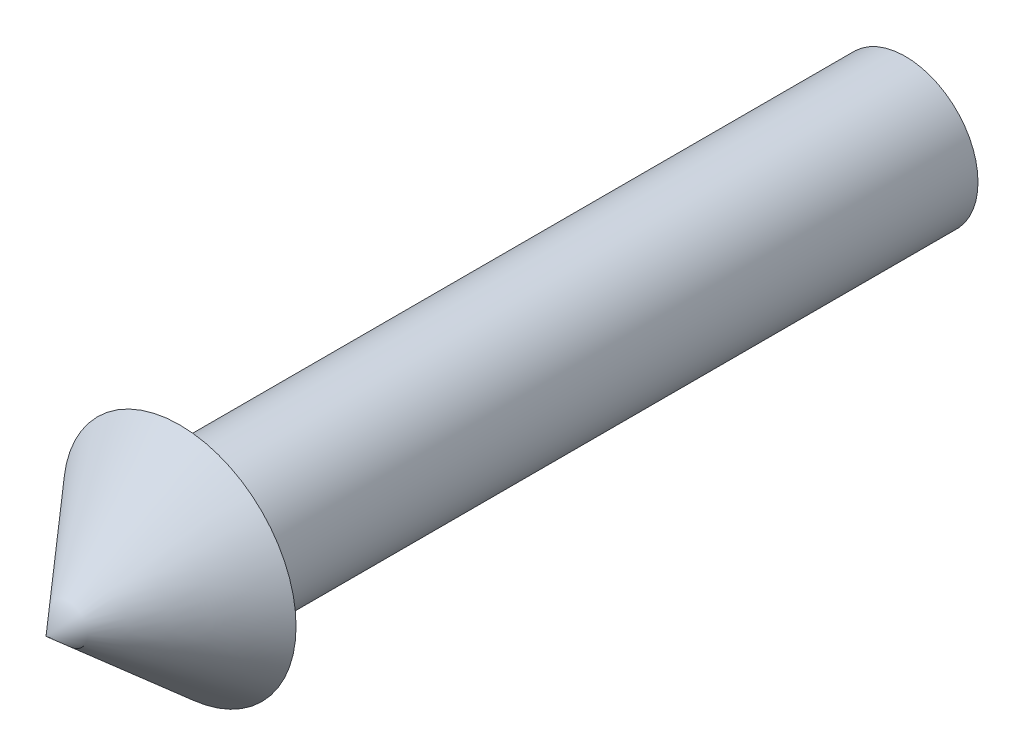
from build123d import *

# Parameters (mm, degrees)
SKETCH_1_R      = 20
EXTRUDE_1_DEPTH = 200


with BuildPart() as part:
    # 草图1 → 凸台-拉伸1 (new body)
    with BuildSketch(Plane.XY):
        Circle(SKETCH_1_R)
    extrude(amount=EXTRUDE_1_DEPTH)

    # 草图3 → 旋转1 (revolve)
    with BuildSketch(Plane(origin=(0, 0, 0), x_dir=(0, 0, -1), z_dir=(1, 0, 0)), mode=Mode.PRIVATE) as revolve_1_sk:
        Polygon((-200, 32.056800214), (-200, 0), (-236.860187008, 0), align=None)
    revolve(revolve_1_sk.sketch.rotate(Axis((0, 0, 200), (0, 0, 1)), 90), axis=Axis((0, 0, 200), (0, 0, 1)))


solid = part.part
